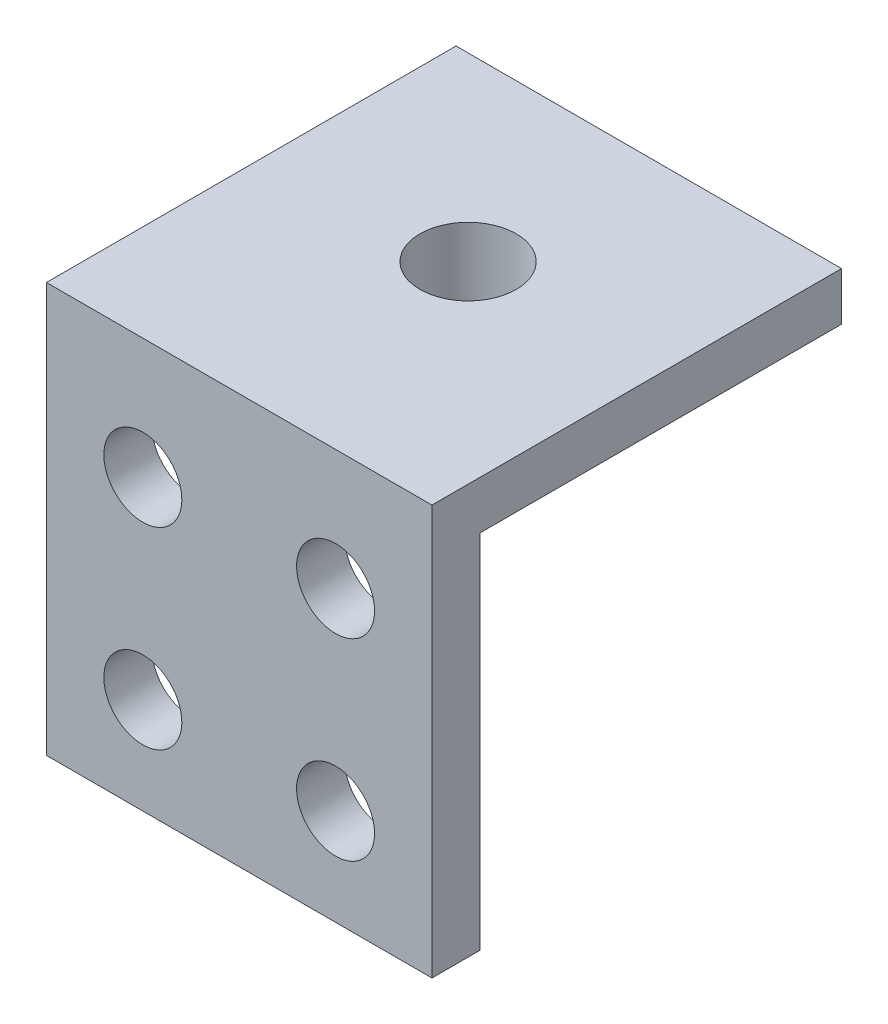
from build123d import *

# Parameters (mm, degrees)
ESQUISSE2_W             = 25.4
ESQUISSE2_H             = 3.175
BOSS_EXTRU_1_DEPTH      = 6.35
ESQUISSE5_R             = 3.175
ENL_V_MAT_EXTRU_1_DEPTH = 34.3375
ESQUISSE7_R             = 2.569510145
ENL_V_MAT_EXTRU_2_DEPTH = 38.060560658


with BuildPart() as part:
    # Balayage1: sweep along a path in Esquisse1
    with BuildLine(Plane(origin=(0, 0, 0), x_dir=(0, 0, -1), z_dir=(1, 0, 0))) as balayage1_path:
        Line((25.4, 0), (0, 0))
        Line((0, 0), (0, -25.4))
    # Esquisse2 → Balayage1 (sweep)
    with BuildSketch(Plane(origin=(0, -25.4, 0), x_dir=(-1, 0, 0), z_dir=(0, 1, 0))):
        Rectangle(ESQUISSE2_W, ESQUISSE2_H)
    sweep(path=balayage1_path.line, transition=Transition.RIGHT)

    # Esquisse3 → Boss.-Extru.1 (add)
    with BuildSketch(Plane.XZ.offset(1.5875)):
        Polygon((2.630256121, -19.84375), (6.35, -16.124006121), (6.35, -10.863493879), (2.630256121, -7.14375), (-2.630256121, -7.14375), (-6.35, -10.863493879), (-6.35, -16.124006121), (-2.630256121, -19.84375), align=None)
    extrude(amount=BOSS_EXTRU_1_DEPTH)

    # Esquisse5 → Enlèv. mat.-Extru.1 (cut, through all)
    with BuildSketch(Plane.XZ.offset(7.9375)):
        with Locations((0, -13.49375)):
            Circle(ESQUISSE5_R)
    extrude(amount=-ENL_V_MAT_EXTRU_1_DEPTH, mode=Mode.SUBTRACT)

    # Esquisse7 → Enlèv. mat.-Extru.2 (cut, through all)
    with BuildSketch(Plane(origin=(0, 0, -1.5875), x_dir=(-1, 0, 0), z_dir=(0, 0, -1))):
        with Locations(Location((-6.35, -19.05, 0), (0, 0, 90))):
            Circle(ESQUISSE7_R)
        with Locations(Location((-6.35, -6.35, 0), (0, 0, 90))):
            Circle(ESQUISSE7_R)
        with Locations(Location((6.35, -19.05, 0), (0, 0, 90))):
            Circle(ESQUISSE7_R)
        with Locations(Location((6.35, -6.35, 0), (0, 0, 90))):
            Circle(ESQUISSE7_R)
    extrude(amount=-ENL_V_MAT_EXTRU_2_DEPTH, mode=Mode.SUBTRACT)


solid = part.part
